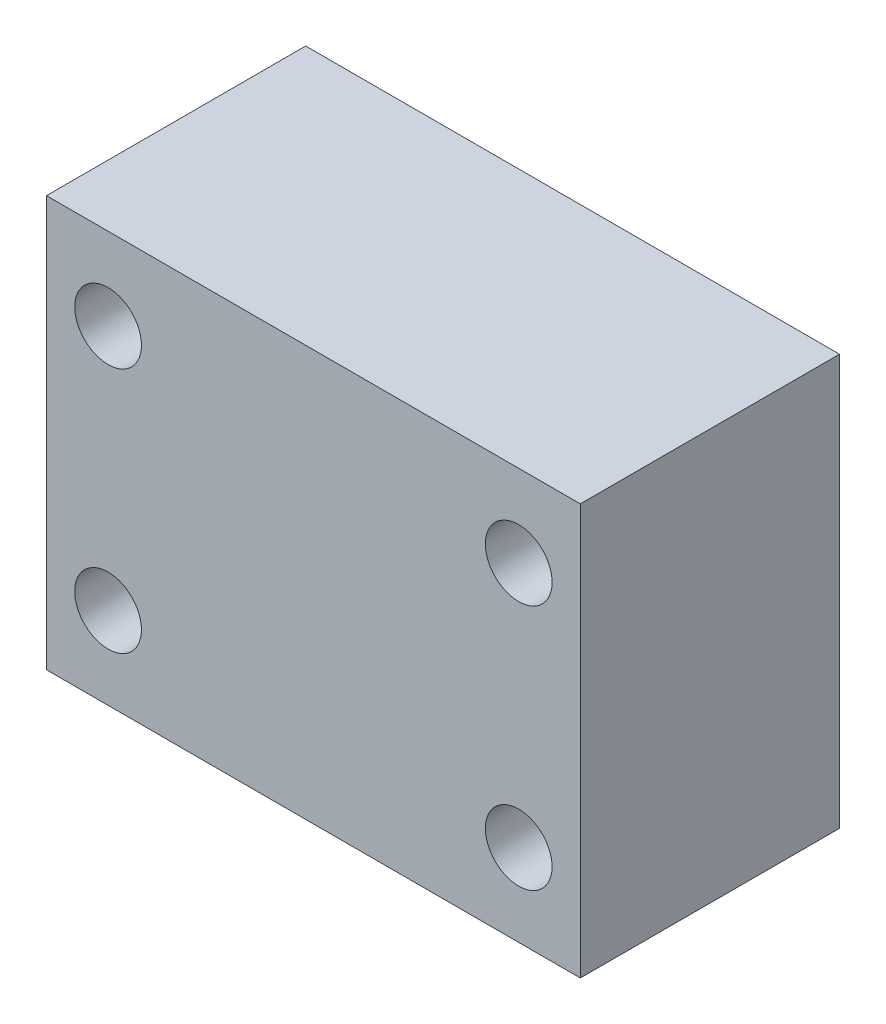
from build123d import *

# Parameters (mm, degrees)
SKETCH1_W           = 52
SKETCH1_H           = 40
BOSS_EXTRUDE1_DEPTH = 12.625
SKETCH2_R           = 3.25
CUT_EXTRUDE1_DEPTH  = 42.395198997


with BuildPart() as part:
    # Sketch1 → Boss-Extrude1 (new, symmetric)
    with BuildSketch(Plane.XY):
        Rectangle(SKETCH1_W, SKETCH1_H)
    extrude(amount=BOSS_EXTRUDE1_DEPTH, both=True)

    # Sketch2 → Cut-Extrude1 (cut, through all)
    with BuildSketch(Plane.XY.offset(12.625)):
        with Locations((-20, 12)):
            Circle(SKETCH2_R)
        with Locations((20, 12)):
            Circle(SKETCH2_R)
        with Locations((-20, -12)):
            Circle(SKETCH2_R)
        with Locations((20, -12)):
            Circle(SKETCH2_R)
    extrude(amount=-CUT_EXTRUDE1_DEPTH, mode=Mode.SUBTRACT)


solid = part.part
